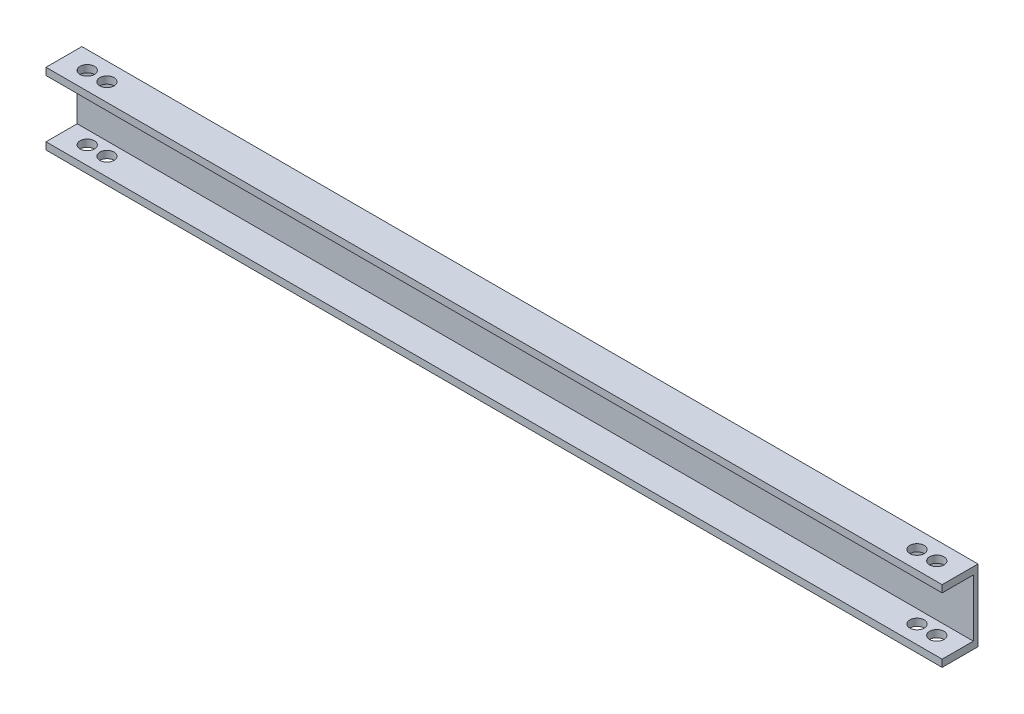
from build123d import *

# Parameters (mm, degrees)
SKETCH1_W           = 635
SKETCH1_H           = 25.4
BOSS_EXTRUDE1_DEPTH = 50.8
SKETCH2_R           = 5.08
CUT_EXTRUDE1_DEPTH  = 53.34
SKETCH3_W           = 635
SKETCH3_H           = 40.64
CUT_EXTRUDE2_DEPTH  = 22.098


with BuildPart() as part:
    # Sketch1 → Boss-Extrude1 (new body)
    with BuildSketch(Plane(origin=(0, 0, 0), x_dir=(1, 0, 0), z_dir=(0, 1, 0))):
        Rectangle(SKETCH1_W, SKETCH1_H)
    extrude(amount=BOSS_EXTRUDE1_DEPTH)

    # Sketch2 → Cut-Extrude1 (cut)
    with BuildSketch(Plane(origin=(0, 50.8, 0), x_dir=(1, 0, 0), z_dir=(0, 1, 0))):
        with Locations(Location((-300.99, 0, 0), (0, 0, 270))):
            Circle(SKETCH2_R)
        with Locations(Location((-287.02, 0, 0), (0, 0, 270))):
            Circle(SKETCH2_R)
        with Locations(Location((300.99, 0, 0), (0, 0, 270))):
            Circle(SKETCH2_R)
        with Locations(Location((287.02, 0, 0), (0, 0, 270))):
            Circle(SKETCH2_R)
    extrude(amount=-CUT_EXTRUDE1_DEPTH, mode=Mode.SUBTRACT)

    # Sketch3 → Cut-Extrude2 (cut)
    with BuildSketch(Plane.XY.offset(12.7)):
        with Locations((0, 25.4)):
            Rectangle(SKETCH3_W, SKETCH3_H)
    extrude(amount=-CUT_EXTRUDE2_DEPTH, mode=Mode.SUBTRACT)


solid = part.part
